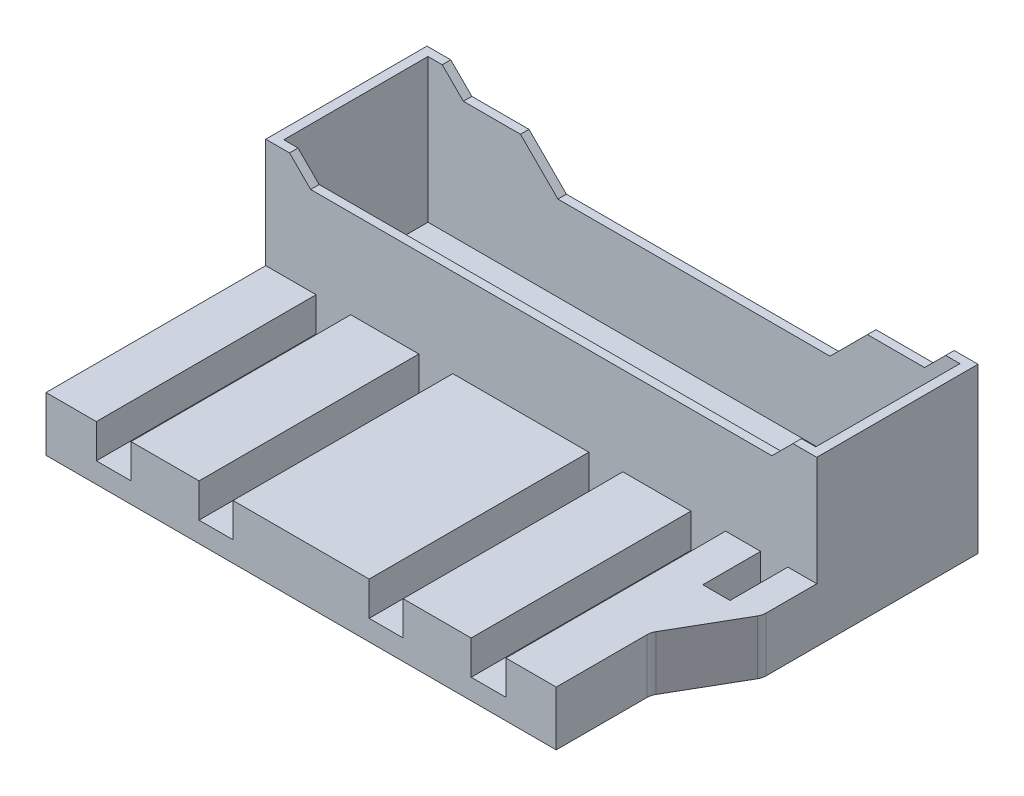
from build123d import *

# Parameters (mm, degrees)
BOSS_EXTRUDE1_DEPTH = 3
SKETCH7_W           = 81
SKETCH7_H           = 23.7
SKETCH7_W_2         = 78.2
SKETCH7_H_2         = 21.2
BOSS_EXTRUDE4_DEPTH = 23.5
CUT_EXTRUDE7_START  = -22.45
CUT_EXTRUDE7_DEPTH  = 22.45
CUT_EXTRUDE8_DEPTH  = 4
CUT_EXTRUDE9_DEPTH  = 4
SKETCH17_W          = 7.4
SKETCH17_H          = 32.3
SKETCH17_W_2        = 10
SKETCH17_W_3        = 20
BOSS_EXTRUDE5_DEPTH = 5
CUT_EXTRUDE10_DEPTH = 1.25
FILLET1_R           = 2


with BuildPart() as part:
    # Sketch1 → Boss-Extrude1 (new body)
    with BuildSketch(Plane(origin=(0, 0, 0), x_dir=(1, 0, 0), z_dir=(0, 1, 0))):
        Polygon((-40.5, -11.85), (-40.5, 11.85), (0, 11.85), (40.5, 11.85), (40.5, -11.85), (40.5, -19.85), (34.5, -30.242304845), (34.5, -44.15), (-40.5, -44.15), align=None)
    extrude(amount=BOSS_EXTRUDE1_DEPTH)

    # Sketch7 → Boss-Extrude4 (add)
    with BuildSketch(Plane(origin=(0, 3, 0), x_dir=(1, 0, 0), z_dir=(0, 1, 0))):
        Rectangle(SKETCH7_W, SKETCH7_H)
        Rectangle(SKETCH7_W_2, SKETCH7_H_2, mode=Mode.SUBTRACT)
    extrude(amount=BOSS_EXTRUDE4_DEPTH)

    # Sketch16 → Cut-Extrude7 (cut)
    with BuildSketch(Plane(origin=(0, 0, -11.85), x_dir=(-1, 0, 0), z_dir=(0, 0, -1)).offset(CUT_EXTRUDE7_START)):
        Polygon((-40.5, 26.5), (40.5, 26.5), (40.5, 24.1), (37, 24.1), (33.9, 21), (25.5, 21), (20, 15.5), (-20, 15.5), (-25.5, 21), (-33.9, 21), (-37, 24.1), (-40.5, 24.1), align=None)
    extrude(amount=CUT_EXTRUDE7_DEPTH, mode=Mode.SUBTRACT)

    # Sketch8 → Cut-Extrude8 (cut)
    with BuildSketch(Plane(origin=(0, 3, 0), x_dir=(1, 0, 0), z_dir=(0, 1, 0))):
        Polygon((33.5, -2), (37.5, -2), (37.5, 2), (-37.5, 2), (-37.5, -2), align=None)
    extrude(amount=-CUT_EXTRUDE8_DEPTH, mode=Mode.SUBTRACT)

    # Sketch14 → Cut-Extrude9 (cut)
    with BuildSketch(Plane(origin=(0, 3, 0), x_dir=(1, 0, 0), z_dir=(0, 1, 0))):
        Polygon((36.25, -11.85), (36.25, -20.35), (32.25, -20.35), (32.25, -11.85), (32.25, 0.15), (36.25, 0.15), align=None)
    extrude(amount=-CUT_EXTRUDE9_DEPTH, mode=Mode.SUBTRACT)

    # Sketch17 → Boss-Extrude5 (add)
    with BuildSketch(Plane(origin=(0, 3, 0), x_dir=(1, 0, 0), z_dir=(0, 1, 0))):
        Polygon((32.25, -20.35), (36.25, -20.35), (36.25, -11.85), (40.5, -11.85), (40.5, -19.85), (34.5, -30.242304845), (34.5, -44.15), (27.1, -44.15), (27.1, -11.85), (32.25, -11.85), align=None)
        with Locations((-36.8, -28)):
            Rectangle(SKETCH17_W, SKETCH17_H)
        with Locations((-23, -28)):
            Rectangle(SKETCH17_W_2, SKETCH17_H)
        with Locations((-3, -28)):
            Rectangle(SKETCH17_W_3, SKETCH17_H)
        with Locations((17, -28)):
            Rectangle(SKETCH17_W_2, SKETCH17_H)
    extrude(amount=BOSS_EXTRUDE5_DEPTH)

    # Sketch18 → Cut-Extrude10 (cut)
    with BuildSketch(Plane(origin=(0, 0, 10.6), x_dir=(-1, 0, 0), z_dir=(0, 0, -1))):
        Polygon((40.5, 26.5), (40.5, 24.1), (37, 24.1), (33.9, 21), (-33.9, 21), (-37, 24.1), (-40.5, 24.1), (-40.5, 26.5), align=None)
    extrude(amount=-CUT_EXTRUDE10_DEPTH, mode=Mode.SUBTRACT)

    # Fillet1
    fillet1_edges = [part.edges().sort_by_distance(p)[0] for p in [
        (40.5, 4, 19.85),
        (34.5, 4, 30.242304845),
    ]]
    fillet(fillet1_edges, radius=FILLET1_R)


solid = part.part
